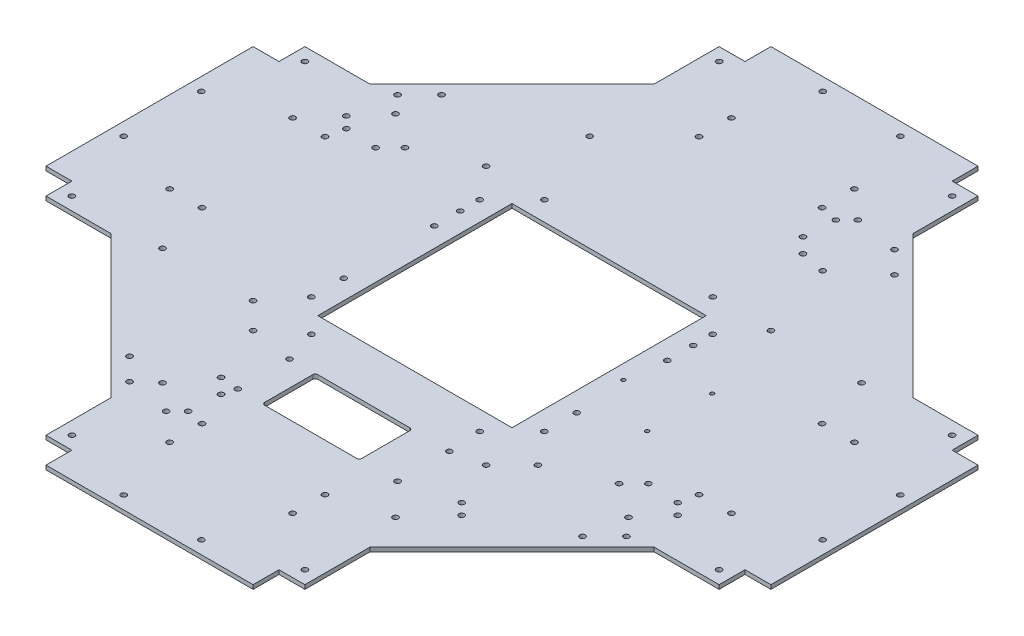
from build123d import *

# Parameters (mm, degrees)
SKETCH1_R           = 2.125
BOSS_EXTRUDE1_DEPTH = 3.175
SKETCH2_R           = 2.125
SKETCH2_R_2         = 2.1
SKETCH2_W           = 150
SKETCH2_H           = 150
SKETCH2_W_2         = 75
SKETCH2_H_2         = 41
CUT_EXTRUDE1_DEPTH  = 396.992525971
FILLET1_R           = 2
SKETCH3_W           = 20
SKETCH3_H           = 20
CUT_EXTRUDE2_DEPTH  = 396.992525971
CUT_EXTRUDE3_REACH  = 397.993
SKETCH4_R           = 1.5


with BuildPart() as part:
    # Sketch1 → Boss-Extrude1 (new body)
    with BuildSketch(Plane(origin=(0, 0, 0), x_dir=(1, 0, 0), z_dir=(0, 1, 0))):
        Polygon((0, -280), (100, -280), (100, -209.601551084), (209.601551084, -100), (280, -100), (280, 0), (280, 100), (209.601551084, 100), (100, 209.601551084), (100, 280), (0, 280), (-100, 280), (-100, 209.601551084), (-209.601551084, 100), (-280, 100), (-280, 0), (-280, -100), (-209.601551084, -100), (-100, -209.601551084), (-100, -280), align=None)
        with Locations(Location((-47.5, -192, 0), (0, 0, 270))):
            Circle(SKETCH1_R, mode=Mode.SUBTRACT)
        with Locations(Location((-47.5, -217, 0), (0, 0, 270))):
            Circle(SKETCH1_R, mode=Mode.SUBTRACT)
        with Locations(Location((47.5, -217, 0), (0, 0, 270))):
            Circle(SKETCH1_R, mode=Mode.SUBTRACT)
        with Locations(Location((47.5, -192, 0), (0, 0, 270))):
            Circle(SKETCH1_R, mode=Mode.SUBTRACT)
        with Locations(Location((-192, 47.5, 0), (0, 0, 270))):
            Circle(SKETCH1_R, mode=Mode.SUBTRACT)
        with Locations(Location((-217, 47.5, 0), (0, 0, 270))):
            Circle(SKETCH1_R, mode=Mode.SUBTRACT)
        with Locations(Location((-192, -47.5, 0), (0, 0, 270))):
            Circle(SKETCH1_R, mode=Mode.SUBTRACT)
        with Locations(Location((-217, -47.5, 0), (0, 0, 270))):
            Circle(SKETCH1_R, mode=Mode.SUBTRACT)
        with Locations(Location((47.5, 192, 0), (0, 0, 270))):
            Circle(SKETCH1_R, mode=Mode.SUBTRACT)
        with Locations(Location((47.5, 217, 0), (0, 0, 270))):
            Circle(SKETCH1_R, mode=Mode.SUBTRACT)
        with Locations(Location((-47.5, 192, 0), (0, 0, 270))):
            Circle(SKETCH1_R, mode=Mode.SUBTRACT)
        with Locations(Location((-47.5, 217, 0), (0, 0, 270))):
            Circle(SKETCH1_R, mode=Mode.SUBTRACT)
        with Locations(Location((192, -47.5, 0), (0, 0, 270))):
            Circle(SKETCH1_R, mode=Mode.SUBTRACT)
        with Locations(Location((217, -47.5, 0), (0, 0, 270))):
            Circle(SKETCH1_R, mode=Mode.SUBTRACT)
        with Locations(Location((192, 47.5, 0), (0, 0, 270))):
            Circle(SKETCH1_R, mode=Mode.SUBTRACT)
        with Locations(Location((217, 47.5, 0), (0, 0, 270))):
            Circle(SKETCH1_R, mode=Mode.SUBTRACT)
        with Locations(Location((-90, -270, 0), (0, 0, 270))):
            Circle(SKETCH1_R, mode=Mode.SUBTRACT)
        with Locations(Location((-30, -270, 0), (0, 0, 270))):
            Circle(SKETCH1_R, mode=Mode.SUBTRACT)
        with Locations(Location((30, -270, 0), (0, 0, 270))):
            Circle(SKETCH1_R, mode=Mode.SUBTRACT)
        with Locations(Location((90, -270, 0), (0, 0, 270))):
            Circle(SKETCH1_R, mode=Mode.SUBTRACT)
        with Locations(Location((-270, 90, 0), (0, 0, 270))):
            Circle(SKETCH1_R, mode=Mode.SUBTRACT)
        with Locations(Location((-270, 30, 0), (0, 0, 270))):
            Circle(SKETCH1_R, mode=Mode.SUBTRACT)
        with Locations(Location((-270, -30, 0), (0, 0, 270))):
            Circle(SKETCH1_R, mode=Mode.SUBTRACT)
        with Locations(Location((-270, -90, 0), (0, 0, 270))):
            Circle(SKETCH1_R, mode=Mode.SUBTRACT)
        with Locations(Location((90, 270, 0), (0, 0, 270))):
            Circle(SKETCH1_R, mode=Mode.SUBTRACT)
        with Locations(Location((30, 270, 0), (0, 0, 270))):
            Circle(SKETCH1_R, mode=Mode.SUBTRACT)
        with Locations(Location((-30, 270, 0), (0, 0, 270))):
            Circle(SKETCH1_R, mode=Mode.SUBTRACT)
        with Locations(Location((-90, 270, 0), (0, 0, 270))):
            Circle(SKETCH1_R, mode=Mode.SUBTRACT)
        with Locations(Location((270, -90, 0), (0, 0, 270))):
            Circle(SKETCH1_R, mode=Mode.SUBTRACT)
        with Locations(Location((270, -30, 0), (0, 0, 270))):
            Circle(SKETCH1_R, mode=Mode.SUBTRACT)
        with Locations(Location((270, 30, 0), (0, 0, 270))):
            Circle(SKETCH1_R, mode=Mode.SUBTRACT)
        with Locations(Location((270, 90, 0), (0, 0, 270))):
            Circle(SKETCH1_R, mode=Mode.SUBTRACT)
        with Locations(Location((-90, -250, 0), (0, 0, 270))):
            Circle(SKETCH1_R, mode=Mode.SUBTRACT)
        with Locations(Location((-90, -180, 0), (0, 0, 270))):
            Circle(SKETCH1_R, mode=Mode.SUBTRACT)
        with Locations(Location((-90, -110, 0), (0, 0, 270))):
            Circle(SKETCH1_R, mode=Mode.SUBTRACT)
        with Locations(Location((-90, -40, 0), (0, 0, 270))):
            Circle(SKETCH1_R, mode=Mode.SUBTRACT)
        with Locations(Location((-90, 30, 0), (0, 0, 270))):
            Circle(SKETCH1_R, mode=Mode.SUBTRACT)
        with Locations(Location((-90, 50, 0), (0, 0, 270))):
            Circle(SKETCH1_R, mode=Mode.SUBTRACT)
        with Locations(Location((-90, 150, 0), (0, 0, 270))):
            Circle(SKETCH1_R, mode=Mode.SUBTRACT)
        with Locations(Location((-90, 250, 0), (0, 0, 270))):
            Circle(SKETCH1_R, mode=Mode.SUBTRACT)
        with Locations(Location((90, -250, 0), (0, 0, 270))):
            Circle(SKETCH1_R, mode=Mode.SUBTRACT)
        with Locations(Location((90, -180, 0), (0, 0, 270))):
            Circle(SKETCH1_R, mode=Mode.SUBTRACT)
        with Locations(Location((90, -110, 0), (0, 0, 270))):
            Circle(SKETCH1_R, mode=Mode.SUBTRACT)
        with Locations(Location((90, -40, 0), (0, 0, 270))):
            Circle(SKETCH1_R, mode=Mode.SUBTRACT)
        with Locations(Location((90, 30, 0), (0, 0, 270))):
            Circle(SKETCH1_R, mode=Mode.SUBTRACT)
        with Locations(Location((90, 50, 0), (0, 0, 270))):
            Circle(SKETCH1_R, mode=Mode.SUBTRACT)
        with Locations(Location((90, 150, 0), (0, 0, 270))):
            Circle(SKETCH1_R, mode=Mode.SUBTRACT)
        with Locations(Location((90, 250, 0), (0, 0, 270))):
            Circle(SKETCH1_R, mode=Mode.SUBTRACT)
        with Locations(Location((-250, -90, 0), (0, 0, 270))):
            Circle(SKETCH1_R, mode=Mode.SUBTRACT)
        with Locations(Location((-180, -90, 0), (0, 0, 270))):
            Circle(SKETCH1_R, mode=Mode.SUBTRACT)
        with Locations(Location((-110, -90, 0), (0, 0, 270))):
            Circle(SKETCH1_R, mode=Mode.SUBTRACT)
        with Locations(Location((-110, 90, 0), (0, 0, 270))):
            Circle(SKETCH1_R, mode=Mode.SUBTRACT)
        with Locations(Location((-180, 90, 0), (0, 0, 270))):
            Circle(SKETCH1_R, mode=Mode.SUBTRACT)
        with Locations(Location((-250, 90, 0), (0, 0, 270))):
            Circle(SKETCH1_R, mode=Mode.SUBTRACT)
        with Locations(Location((110, -90, 0), (0, 0, 270))):
            Circle(SKETCH1_R, mode=Mode.SUBTRACT)
        with Locations(Location((180, -90, 0), (0, 0, 270))):
            Circle(SKETCH1_R, mode=Mode.SUBTRACT)
        with Locations(Location((250, -90, 0), (0, 0, 270))):
            Circle(SKETCH1_R, mode=Mode.SUBTRACT)
        with Locations(Location((110, 90, 0), (0, 0, 270))):
            Circle(SKETCH1_R, mode=Mode.SUBTRACT)
        with Locations(Location((180, 90, 0), (0, 0, 270))):
            Circle(SKETCH1_R, mode=Mode.SUBTRACT)
        with Locations(Location((250, 90, 0), (0, 0, 270))):
            Circle(SKETCH1_R, mode=Mode.SUBTRACT)
    extrude(amount=BOSS_EXTRUDE1_DEPTH)

    # Sketch2 → Cut-Extrude1 (cut, through all)
    with BuildSketch(Plane(origin=(0, 3.175, 0), x_dir=(1, 0, 0), z_dir=(0, 1, 0))):
        with Locations(Location((66.6, -115, 0), (0, 0, 270))):
            Circle(SKETCH2_R)
        with Locations(Location((-90, 65, 0), (0, 0, 270))):
            Circle(SKETCH2_R)
        with Locations(Location((-90, -65, 0), (0, 0, 90))):
            Circle(SKETCH2_R)
        with Locations(Location((90, -65, 0), (0, 0, 270))):
            Circle(SKETCH2_R)
        with Locations(Location((90, 65, 0), (0, 0, 90))):
            Circle(SKETCH2_R)
        with Locations(Location((-65, 90, 0), (0, 0, 270))):
            Circle(SKETCH2_R)
        with Locations(Location((65, 90, 0), (0, 0, 90))):
            Circle(SKETCH2_R)
        with Locations(Location((65, -90, 0), (0, 0, 270))):
            Circle(SKETCH2_R)
        with Locations(Location((-65, -90, 0), (0, 0, 90))):
            Circle(SKETCH2_R)
        with Locations(Location((66.6, -155, 0), (0, 0, 90))):
            Circle(SKETCH2_R)
        with Locations(Location((-56.9, -115, 0), (0, 0, 270))):
            Circle(SKETCH2_R_2)
        with Locations(Location((-56.9, -155, 0), (0, 0, 90))):
            Circle(SKETCH2_R_2)
        with Locations(Location((174.953318806, -120.506096654, 0), (0, 0, 270))):
            Circle(SKETCH2_R)
        with Locations(Location((191.923881554, -103.535533906, 0), (0, 0, 270))):
            Circle(SKETCH2_R)
        with Locations(Location((153.736977236, -71.011760106, 0), (0, 0, 270))):
            Circle(SKETCH2_R)
        with Locations(Location((165.050685735, -59.698051607, 0), (0, 0, 270))):
            Circle(SKETCH2_R)
        with Locations(Location((-120.506096654, -174.953318806, 0), (0, 0, 270))):
            Circle(SKETCH2_R)
        with Locations(Location((-103.535533906, -191.923881554, 0), (0, 0, 270))):
            Circle(SKETCH2_R)
        with Locations(Location((-71.011760106, -153.736977236, 0), (0, 0, 270))):
            Circle(SKETCH2_R)
        with Locations(Location((-59.698051607, -165.050685735, 0), (0, 0, 270))):
            Circle(SKETCH2_R)
        with Locations(Location((-174.953318806, 120.506096654, 0), (0, 0, 270))):
            Circle(SKETCH2_R)
        with Locations(Location((-191.923881554, 103.535533906, 0), (0, 0, 270))):
            Circle(SKETCH2_R)
        with Locations(Location((-153.736977236, 71.011760106, 0), (0, 0, 270))):
            Circle(SKETCH2_R)
        with Locations(Location((-165.050685735, 59.698051607, 0), (0, 0, 270))):
            Circle(SKETCH2_R)
        with Locations(Location((120.506096654, 174.953318806, 0), (0, 0, 270))):
            Circle(SKETCH2_R)
        with Locations(Location((103.535533906, 191.923881554, 0), (0, 0, 270))):
            Circle(SKETCH2_R)
        with Locations(Location((71.011760106, 153.736977236, 0), (0, 0, 270))):
            Circle(SKETCH2_R)
        with Locations(Location((59.698051607, 165.050685735, 0), (0, 0, 270))):
            Circle(SKETCH2_R)
        with Locations(Location((114.142135624, -153.033008589, 0), (0, 0, 270))):
            Circle(SKETCH2_R)
        with Locations(Location((105.656854249, -144.547727215, 0), (0, 0, 270))):
            Circle(SKETCH2_R_2)
        with Locations(Location((197.580735804, -69.594408409, 0), (0, 0, 90))):
            Circle(SKETCH2_R)
        with Locations(Location((189.09545443, -61.109127035, 0), (0, 0, 90))):
            Circle(SKETCH2_R_2)
        with Locations(Location((-61.109127035, -189.09545443, 0), (0, 0, 90))):
            Circle(SKETCH2_R_2)
        with Locations(Location((-69.594408409, -197.580735804, 0), (0, 0, 90))):
            Circle(SKETCH2_R)
        with Locations(Location((-189.09545443, 61.109127035, 0), (0, 0, 90))):
            Circle(SKETCH2_R_2)
        with Locations(Location((-197.580735804, 69.594408409, 0), (0, 0, 90))):
            Circle(SKETCH2_R)
        with Locations(Location((61.109127035, 189.09545443, 0), (0, 0, 90))):
            Circle(SKETCH2_R_2)
        with Locations(Location((69.594408409, 197.580735804, 0), (0, 0, 90))):
            Circle(SKETCH2_R)
        Rectangle(SKETCH2_W, SKETCH2_H)
        with Locations((0, -135)):
            Rectangle(SKETCH2_W_2, SKETCH2_H_2)
    extrude(amount=-CUT_EXTRUDE1_DEPTH, mode=Mode.SUBTRACT)

    # Fillet1
    fillet1_edges = [part.edges().sort_by_distance(p)[0] for p in [
        (37.5, 1.5875, 114.5),
        (37.5, 1.5875, 155.5),
        (-37.5, 1.5875, 155.5),
        (-37.5, 1.5875, 114.5),
    ]]
    fillet(fillet1_edges, radius=FILLET1_R)

    # Sketch3 → Cut-Extrude2 (cut, through all)
    with BuildSketch(Plane(origin=(0, 3.175, 0), x_dir=(1, 0, 0), z_dir=(0, 1, 0))):
        with Locations((-270, 90)):
            Rectangle(SKETCH3_W, SKETCH3_H)
        with Locations((90, -270)):
            Rectangle(SKETCH3_W, SKETCH3_H)
        with Locations((-90, -270)):
            Rectangle(SKETCH3_W, SKETCH3_H)
        with Locations((-270, -90)):
            Rectangle(SKETCH3_W, SKETCH3_H)
        with Locations((90, 270)):
            Rectangle(SKETCH3_W, SKETCH3_H)
        with Locations((-90, 270)):
            Rectangle(SKETCH3_W, SKETCH3_H)
        with Locations((270, -90)):
            Rectangle(SKETCH3_W, SKETCH3_H)
        with Locations((270, 90)):
            Rectangle(SKETCH3_W, SKETCH3_H)
    extrude(amount=-CUT_EXTRUDE2_DEPTH, mode=Mode.SUBTRACT)

    # Sketch4 → Cut-Extrude3 (cut, up to next)
    with BuildSketch(Plane(origin=(0, 3.175, 0), x_dir=(1, 0, 0), z_dir=(0, 1, 0)), mode=Mode.PRIVATE) as cut_extrude3_sk1:
        with Locations(Location((129.5, -25.11473671, 0), (0, 0, 270))):
            Circle(SKETCH4_R)
    cut_extrude3_tool1 = extrude(cut_extrude3_sk1.sketch, amount=-CUT_EXTRUDE3_REACH, mode=Mode.PRIVATE) & part.part
    # Sketch4 → Cut-Extrude3 (cut, up to next)
    with BuildSketch(Plane(origin=(0, 3.175, 0), x_dir=(1, 0, 0), z_dir=(0, 1, 0)), mode=Mode.PRIVATE) as cut_extrude3_sk2:
        with Locations(Location((86, 0, 0), (0, 0, 270))):
            Circle(SKETCH4_R)
    cut_extrude3_tool2 = extrude(cut_extrude3_sk2.sketch, amount=-CUT_EXTRUDE3_REACH, mode=Mode.PRIVATE) & part.part
    # Sketch4 → Cut-Extrude3 (cut, up to next)
    with BuildSketch(Plane(origin=(0, 3.175, 0), x_dir=(1, 0, 0), z_dir=(0, 1, 0)), mode=Mode.PRIVATE) as cut_extrude3_sk3:
        with Locations(Location((129.5, 25.11473671, 0), (0, 0, 270))):
            Circle(SKETCH4_R)
    cut_extrude3_tool3 = extrude(cut_extrude3_sk3.sketch, amount=-CUT_EXTRUDE3_REACH, mode=Mode.PRIVATE) & part.part
    add(cut_extrude3_tool1.solids().sort_by_distance((129.5, 3.175, 25.114737))[0], mode=Mode.SUBTRACT)
    add(cut_extrude3_tool2.solids().sort_by_distance((86, 3.175, 0))[0], mode=Mode.SUBTRACT)
    add(cut_extrude3_tool3.solids().sort_by_distance((129.5, 3.175, -25.114737))[0], mode=Mode.SUBTRACT)


solid = part.part
